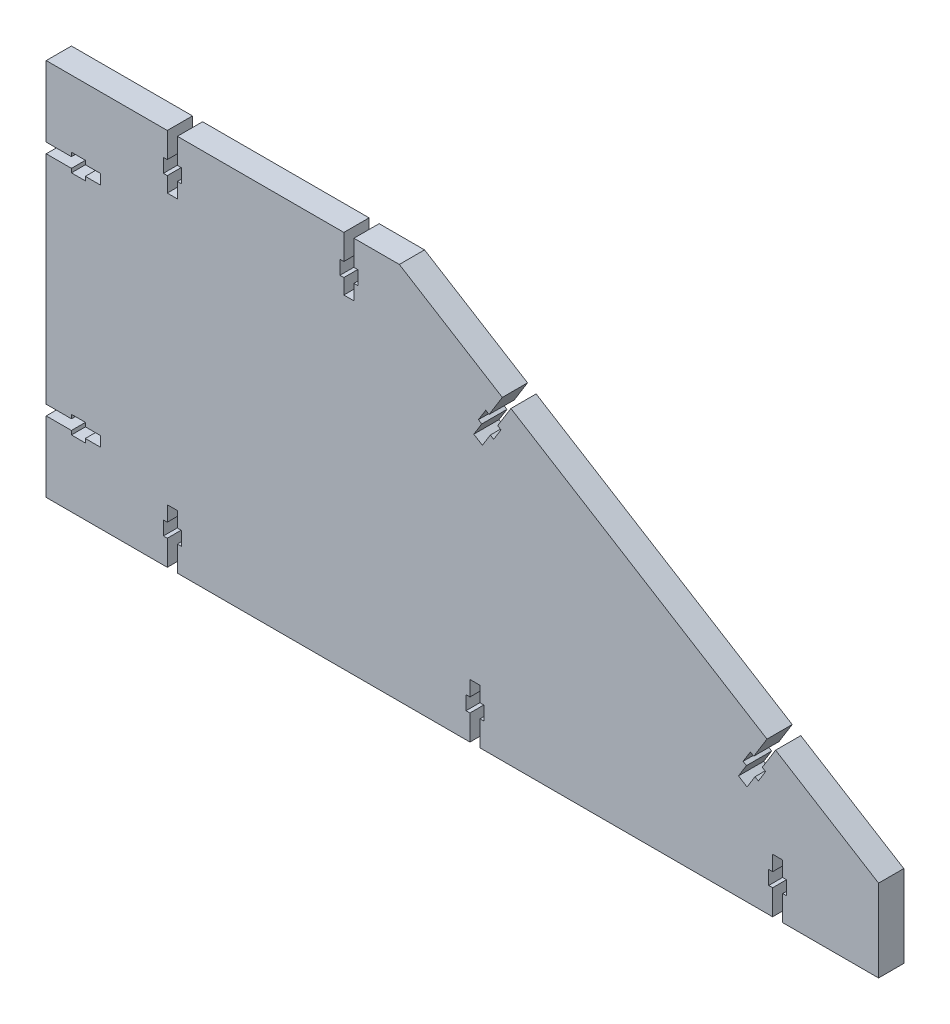
from build123d import *

# Parameters (mm, degrees)
BOSS_EXTRU_1_DEPTH      = 10
ENL_V_MAT_EXTRU_1_DEPTH = 10
ENL_V_MAT_EXTRU_2_DEPTH = 10
ENL_V_MAT_EXTRU_3_DEPTH = 10


with BuildPart() as part:
    # Esquisse1 → Boss.-Extru.1 (new body)
    with BuildSketch(Plane.XY):
        Polygon((0, 0), (140, 0), (330, -117.424565968), (330, -150), (0, -150), align=None)
    extrude(amount=BOSS_EXTRU_1_DEPTH)

    # Esquisse2 → Enlèv. mat.-Extru.1 (cut)
    with BuildSketch(Plane.XY.offset(10)):
        Polygon((48, -140), (48, -150), (52, -150), (52, -140), (53.55, -140), (53.55, -134.5), (52, -134.5), (52, -128.5), (48, -128.5), (48, -134.5), (46.45, -134.5), (46.45, -140), align=None)
        Polygon((168, -140), (168, -150), (172, -150), (172, -140), (173.55, -140), (173.55, -134.5), (172, -134.5), (172, -128.5), (168, -128.5), (168, -134.5), (166.45, -134.5), (166.45, -140), align=None)
        Polygon((288, -140), (288, -150), (292, -150), (292, -140), (293.55, -140), (293.55, -134.5), (292, -134.5), (292, -128.5), (288, -128.5), (288, -134.5), (286.45, -134.5), (286.45, -140), align=None)
        Polygon((10, -28), (0, -28), (0, -32), (10, -32), (10, -33.55), (15.5, -33.55), (15.5, -32), (21.5, -32), (21.5, -28), (15.5, -28), (15.5, -26.45), (10, -26.45), align=None)
        Polygon((10, -118), (0, -118), (0, -122), (10, -122), (10, -123.55), (15.5, -123.55), (15.5, -122), (21.5, -122), (21.5, -118), (15.5, -118), (15.5, -116.45), (10, -116.45), align=None)
    extrude(amount=-ENL_V_MAT_EXTRU_1_DEPTH, mode=Mode.SUBTRACT)

    # Esquisse3 → Enlèv. mat.-Extru.2 (cut)
    with BuildSketch(Plane.XY.offset(10)):
        Polygon((48, 0), (48, -10), (46.45, -10), (46.45, -15.5), (48, -15.5), (48, -21.5), (52, -21.5), (52, -15.5), (53.55, -15.5), (53.55, -10), (52, -10), (52, 0), align=None)
        Polygon((118, 0), (118, -10), (116.45, -10), (116.45, -15.5), (118, -15.5), (118, -21.5), (122, -21.5), (122, -15.5), (123.55, -15.5), (123.55, -10), (122, -10), (122, 0), align=None)
    extrude(amount=-ENL_V_MAT_EXTRU_2_DEPTH, mode=Mode.SUBTRACT)

    # Esquisse4 → Enlèv. mat.-Extru.3 (cut)
    with BuildSketch(Plane.XY.offset(10)):
        Polygon((180.831420624, -25.234799183), (175.574170795, -33.741345146), (174.25565617, -32.926471422), (171.364168764, -37.605071702), (172.682683388, -38.419945426), (169.528333491, -43.523873004), (172.930951876, -45.626772936), (176.085301774, -40.522845358), (177.403816398, -41.337719081), (180.295303804, -36.659118802), (178.97678918, -35.844245078), (184.23403901, -27.337699114), align=None)
        Polygon((285.76596099, -90.086866854), (280.50871116, -98.593412817), (279.190196536, -97.778539093), (276.29870913, -102.457139373), (277.617223754, -103.272013097), (274.462873856, -108.375940675), (277.865492242, -110.478840607), (281.019842139, -105.374913029), (282.338356764, -106.189786752), (285.22984417, -101.511186473), (283.911329546, -100.696312749), (289.168579376, -92.189766786), align=None)
    extrude(amount=-ENL_V_MAT_EXTRU_3_DEPTH, mode=Mode.SUBTRACT)


solid = part.part
